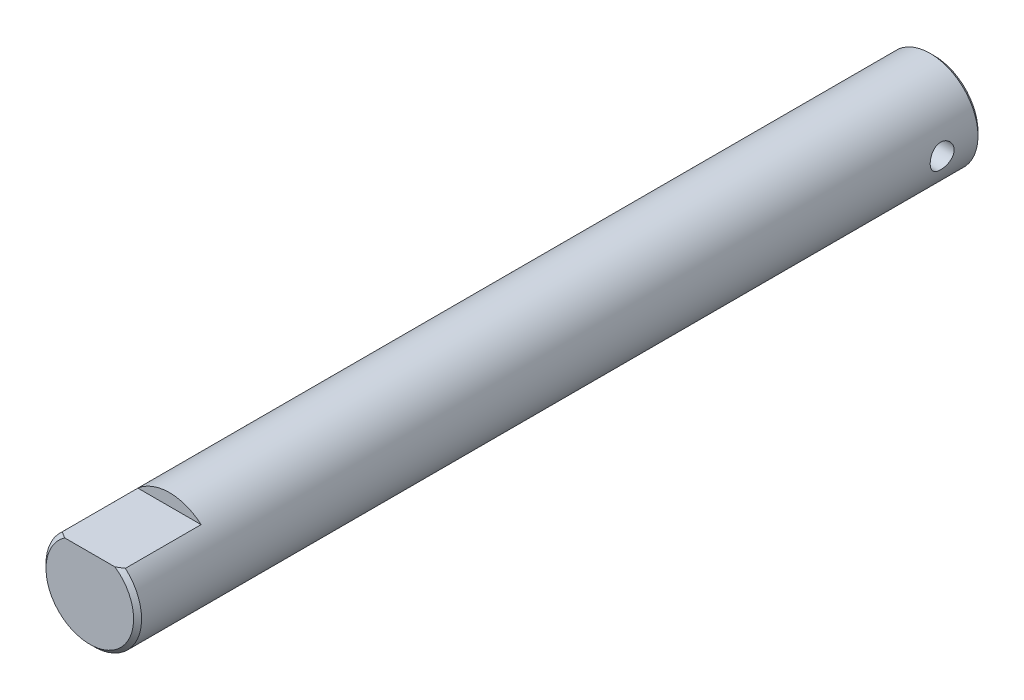
from build123d import *

# Parameters (mm, degrees)
SKETCH1_R               = 6
BOSS_EXTRUDE1_DEPTH     = 53
CHAMFER1_SIZE           = 0.5
CUT_EXTRUDE1_DEPTH      = 54.674947601
CUT_EXTRUDE1_DEPTH_BACK = 54.674947601
SKETCH2_R               = 1.5
CUT_EXTRUDE2_START      = 4.5
SKETCH3_W               = 12
SKETCH3_H               = 10
CUT_EXTRUDE2_DEPTH      = 10


with BuildPart() as part:
    # Sketch1 → Boss-Extrude1 (new, symmetric)
    with BuildSketch(Plane.XY):
        Circle(SKETCH1_R)
    extrude(amount=BOSS_EXTRUDE1_DEPTH, both=True)

    # Chamfer1
    chamfer1_edges = [part.edges().sort_by_distance(p)[0] for p in [
        (-6, 0, -53),
        (-6, 0, 53),
    ]]
    chamfer(chamfer1_edges, length=CHAMFER1_SIZE)

    # Sketch2 → Cut-Extrude1 (cut, two sides: drawn at the far end of the back side and taken through both)
    with BuildSketch(Plane(origin=(0, 0, 0), x_dir=(0, 0, -1), z_dir=(1, 0, 0)).offset(-CUT_EXTRUDE1_DEPTH_BACK)):
        with Locations((48, 0)):
            Circle(SKETCH2_R)
    extrude(amount=CUT_EXTRUDE1_DEPTH + CUT_EXTRUDE1_DEPTH_BACK, mode=Mode.SUBTRACT)

    # Sketch3 → Cut-Extrude2 (cut)
    with BuildSketch(Plane(origin=(0, 0, 0), x_dir=(1, 0, 0), z_dir=(0, 1, 0)).offset(CUT_EXTRUDE2_START)):
        with Locations((0.952060287, -48)):
            Rectangle(SKETCH3_W, SKETCH3_H)
    extrude(amount=CUT_EXTRUDE2_DEPTH, mode=Mode.SUBTRACT)


solid = part.part
